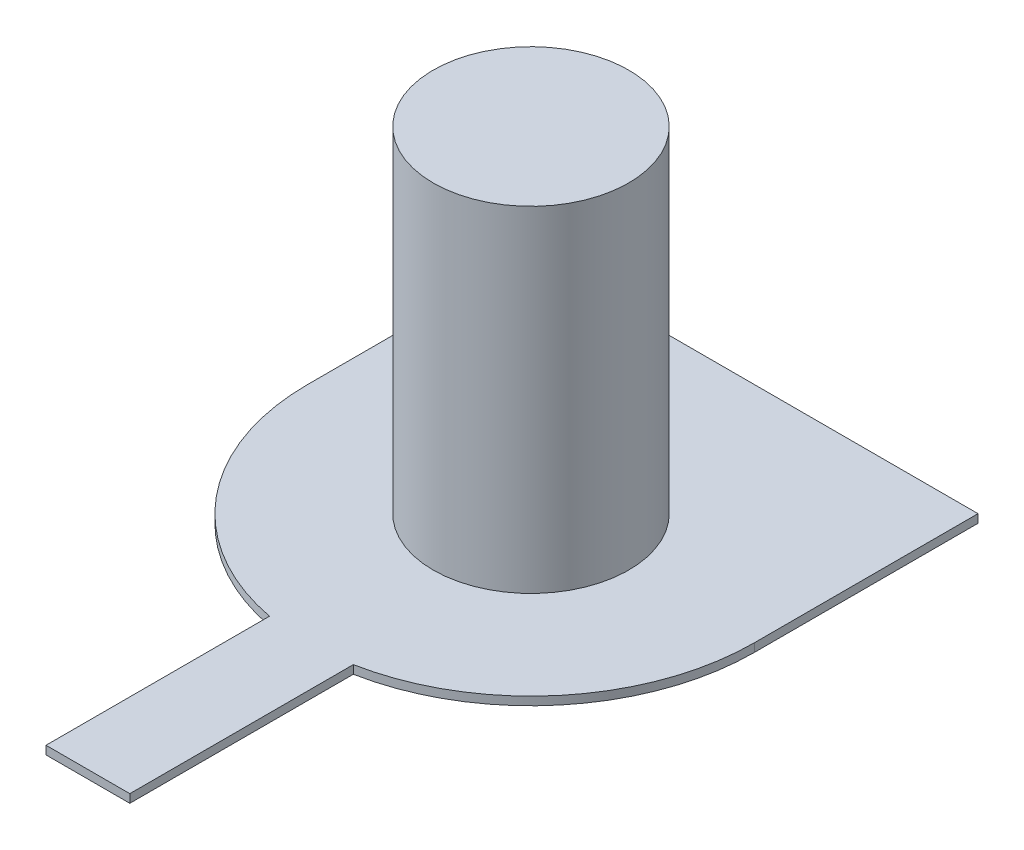
from build123d import *

# Parameters (mm, degrees)
EXTRUDE_1_DEPTH = 0.3
SKETCH_2_R      = 3.5
EXTRUDE_2_DEPTH = 12


with BuildPart() as part:
    # 草图1 → 凸台-拉伸1 (new body)
    with BuildSketch(Plane(origin=(0, 0, 0), x_dir=(1, 0, 0), z_dir=(0, 1, 0))):
        with BuildLine():
            Line((-8, 0), (-8, 8))
            Line((-8, 8), (8, 8))
            Line((8, 8), (8, 0))
            ThreePointArc((8, 0), (6.164414003, -5.099019514), (1.5, -7.858116823))
            Line((1.5, -7.858116823), (1.5, -15.858116823))
            Line((1.5, -15.858116823), (-1.5, -15.858116823))
            Line((-1.5, -15.858116823), (-1.5, -7.858116823))
            ThreePointArc((-1.5, -7.858116823), (-6.164414003, -5.099019514), (-8, 0))
        make_face()
    extrude(amount=EXTRUDE_1_DEPTH)

    # 草图2 → 凸台-拉伸2 (add)
    with BuildSketch(Plane(origin=(0, 0.3, 0), x_dir=(1, 0, 0), z_dir=(0, 1, 0))):
        with Locations(Location((0, 0, 0), (0, 0, 270))):
            Circle(SKETCH_2_R)
    extrude(amount=EXTRUDE_2_DEPTH)


solid = part.part
